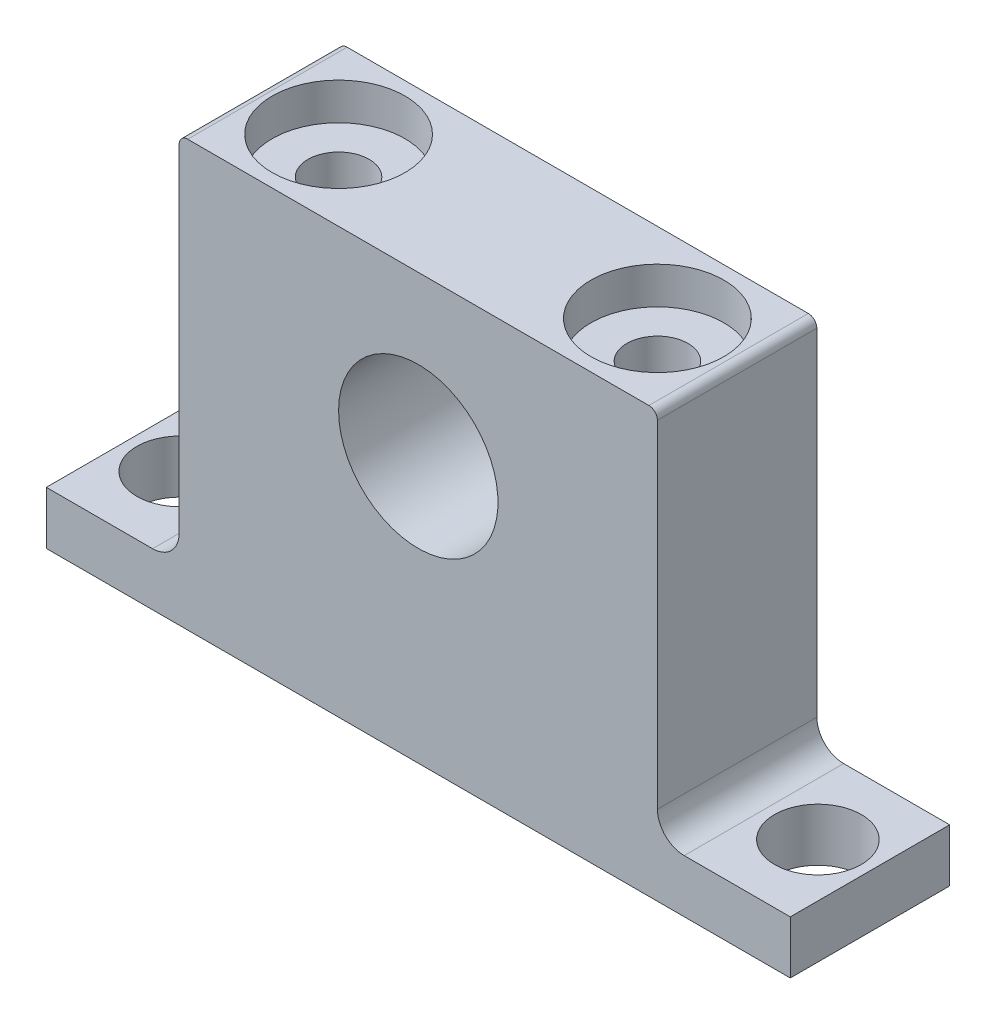
from build123d import *

# Parameters (mm, degrees)
SKETCH1_R                                           = 4.7625
BOSS_EXTRUDE2_DEPTH                                 = 9.525
CBORE_FOR_6_BINDING_HEAD_MACHINE_SCREW1_D           = 3.6576
CBORE_FOR_6_BINDING_HEAD_MACHINE_SCREW1_DEPTH       = 14.224
CBORE_FOR_6_BINDING_HEAD_MACHINE_SCREW1_CBORE_D     = 7.9375
CBORE_FOR_6_BINDING_HEAD_MACHINE_SCREW1_CBORE_DEPTH = 2.2098
CBORE_FOR_6_BINDING_HEAD_MACHINE_SCREW1_TIP         = 1.0988539
F_6_0_204_DIAMETER_HOLE1_D                          = 5.1816


with BuildPart() as part:
    # Sketch1 → Boss-Extrude2 (new body)
    with BuildSketch(Plane.XY):
        with BuildLine():
            Line((22.225, -12.7), (-22.225, -12.7))
            Line((-22.225, -12.7), (-22.225, -9.535669584))
            Line((-22.225, -9.535669584), (-15.875, -9.535669584))
            ThreePointArc((-15.875, -9.535669584), (-14.752467985, -9.070701599), (-14.2875, -7.948169584))
            Line((-14.2875, -7.948169584), (-14.2875, 3.175))
            Line((-14.2875, 3.175), (-14.2875, 12.192))
            ThreePointArc((-14.2875, 12.192), (-14.138710245, 12.551210245), (-13.7795, 12.7))
            Line((-13.7795, 12.7), (13.7795, 12.7))
            ThreePointArc((13.7795, 12.7), (14.138710245, 12.551210245), (14.2875, 12.192))
            Line((14.2875, 12.192), (14.2875, 3.175))
            Line((14.2875, 3.175), (14.2875, -7.934401915))
            ThreePointArc((14.2875, -7.934401915), (14.756500442, -9.066669142), (15.888767669, -9.535669584))
            Line((15.888767669, -9.535669584), (22.225, -9.535669584))
            Line((22.225, -9.535669584), (22.225, -12.7))
        make_face()
        with Locations(Location((0, 3.175, 0), (0, 0, 180))):
            Circle(SKETCH1_R, mode=Mode.SUBTRACT)
    extrude(amount=BOSS_EXTRUDE2_DEPTH)

    # CBORE for #6 Binding Head Machine Screw1
    with Locations(Plane(origin=(0, 12.7, 0), x_dir=(1, 0, 0), z_dir=(0, 1, 0))):
        with Locations((9.525, -4.7625), (-9.525, -4.7625)):
            CounterBoreHole(CBORE_FOR_6_BINDING_HEAD_MACHINE_SCREW1_D / 2, CBORE_FOR_6_BINDING_HEAD_MACHINE_SCREW1_CBORE_D / 2, CBORE_FOR_6_BINDING_HEAD_MACHINE_SCREW1_CBORE_DEPTH, depth=CBORE_FOR_6_BINDING_HEAD_MACHINE_SCREW1_DEPTH)
            with Locations((0, 0, -(CBORE_FOR_6_BINDING_HEAD_MACHINE_SCREW1_DEPTH + CBORE_FOR_6_BINDING_HEAD_MACHINE_SCREW1_TIP / 2))):  # 118° drill point
                Cone(0, CBORE_FOR_6_BINDING_HEAD_MACHINE_SCREW1_D / 2, CBORE_FOR_6_BINDING_HEAD_MACHINE_SCREW1_TIP, mode=Mode.SUBTRACT)

    # #6 (0.204) Diameter Hole1 (through all)
    with Locations(Plane(origin=(0, -9.535669584, 0), x_dir=(1, 0, 0), z_dir=(0, 1, 0))):
        with Locations((-19.05, -4.699018138), (19.05, -4.699018138)):
            Hole(F_6_0_204_DIAMETER_HOLE1_D / 2)


solid = part.part
